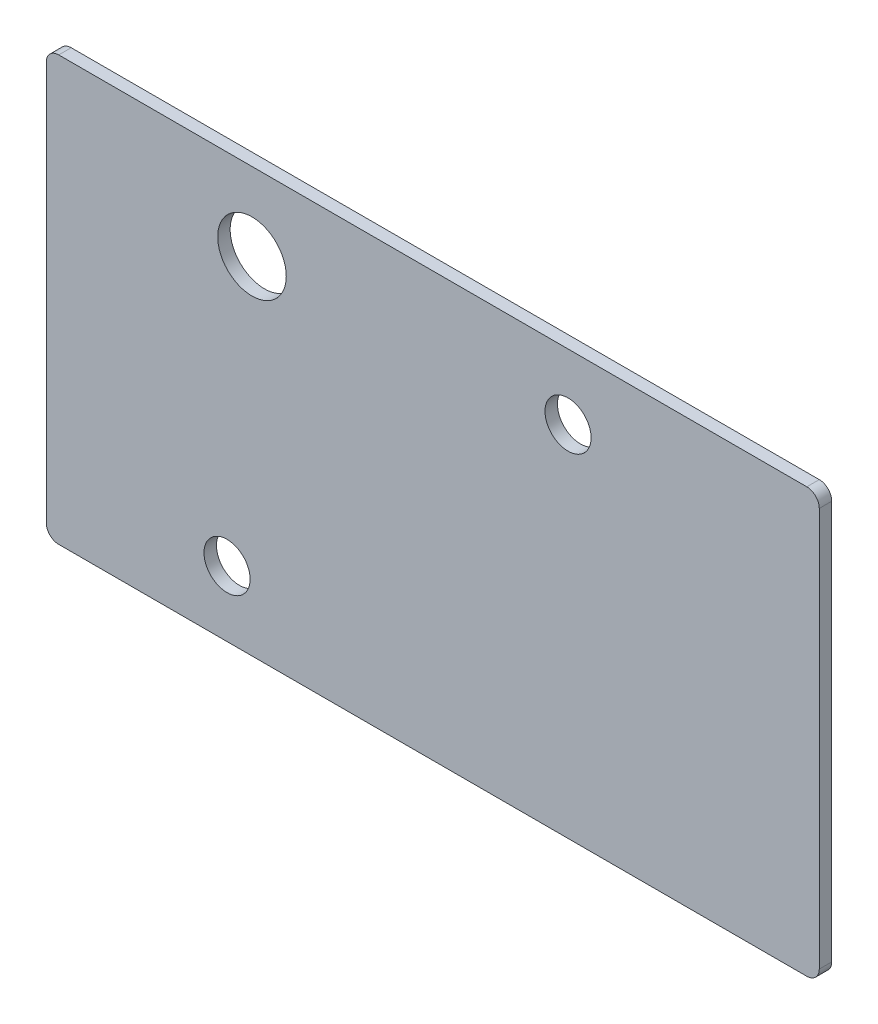
from build123d import *

# Parameters (mm, degrees)
CROQUIS1_R              = 1.85
SALIENTE_EXTRUIR1_DEPTH = 1
CROQUIS2_R              = 2.75
CORTAR_EXTRUIR1_DEPTH   = 65.382159796


with BuildPart() as part:
    # Croquis1 → Saliente-Extruir1 (new body)
    with BuildSketch(Plane.XY):
        with BuildLine():
            Line((-5, 31.75), (55, 31.75))
            ThreePointArc((55, 31.75), (55.707106781, 31.457106781), (56, 30.75))
            Line((56, 30.75), (56, -1.25))
            ThreePointArc((56, -1.25), (55.707106781, -1.957106781), (55, -2.25))
            Line((55, -2.25), (-5, -2.25))
            ThreePointArc((-5, -2.25), (-5.707106781, -1.957106781), (-6, -1.25))
            Line((-6, -1.25), (-6, 30.75))
            ThreePointArc((-6, 30.75), (-5.707106781, 31.457106781), (-5, 31.75))
        make_face()
        with Locations((35.85, 26.5)):
            Circle(CROQUIS1_R, mode=Mode.SUBTRACT)
        with Locations((8.5, 3)):
            Circle(CROQUIS1_R, mode=Mode.SUBTRACT)
    extrude(amount=SALIENTE_EXTRUIR1_DEPTH)

    # Croquis2 → Cortar-Extruir1 (cut, through all)
    with BuildSketch(Plane.XY.offset(1)):
        with Locations((10.5, 25.5)):
            Circle(CROQUIS2_R)
    extrude(amount=-CORTAR_EXTRUIR1_DEPTH, mode=Mode.SUBTRACT)


solid = part.part
